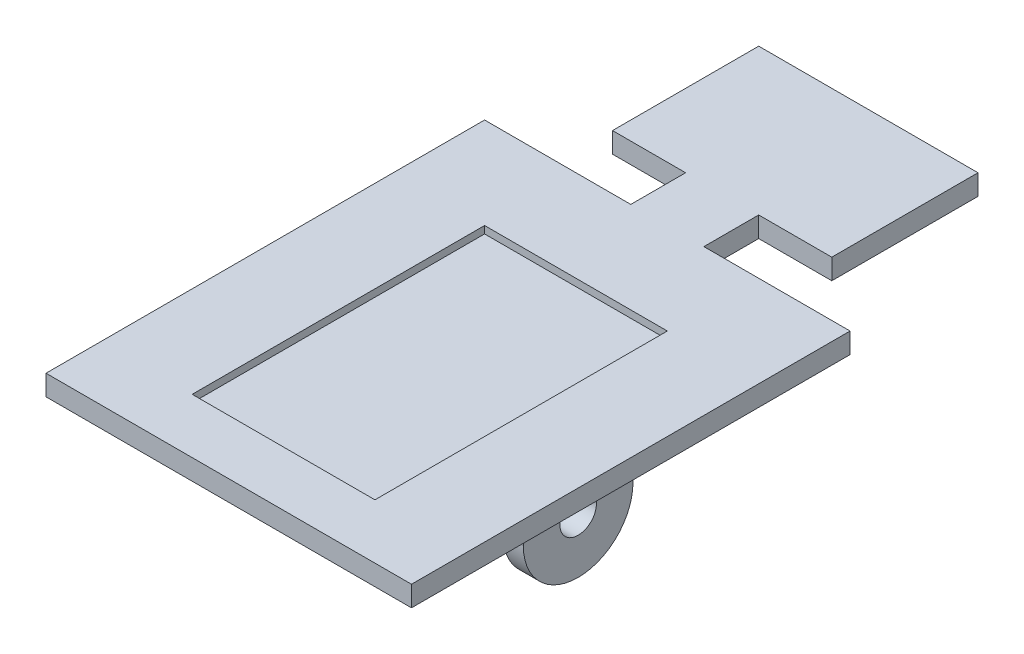
from build123d import *

# Parameters (mm, degrees)
BOSS_EXTRUDE1_DEPTH     = 2.8
SKETCH3_W               = 25
SKETCH3_H               = 40
CUT_EXTRUDE1_DEPTH      = 1
SKETCH4_W               = 2.8
SKETCH4_H               = 15
BOSS_EXTRUDE2_DEPTH     = 15
CUT_EXTRUDE2_DEPTH      = 76.211967133
CUT_EXTRUDE2_DEPTH_BACK = 76.211967133
SKETCH5_R               = 2.5


with BuildPart() as part:
    # Sketch2 → Boss-Extrude1 (new body)
    with BuildSketch(Plane(origin=(0, 0, 0), x_dir=(1, 0, 0), z_dir=(0, 1, 0))):
        Polygon((-15, 27.5), (15, 27.5), (15, 7.5), (5, 7.5), (5, 0), (25, 0), (25, -60), (-25, -60), (-25, 0), (-5, 0), (-5, 7.5), (-15, 7.5), align=None)
    extrude(amount=BOSS_EXTRUDE1_DEPTH)

    # Sketch3 → Cut-Extrude1 (cut)
    with BuildSketch(Plane(origin=(0, 2.8, 0), x_dir=(1, 0, 0), z_dir=(0, 1, 0))):
        with Locations((0, -32.5)):
            Rectangle(SKETCH3_W, SKETCH3_H)
    extrude(amount=-CUT_EXTRUDE1_DEPTH, mode=Mode.SUBTRACT)

    # Sketch4 → Boss-Extrude2 (add)
    with BuildSketch(Plane.XZ):
        with Locations((16.4, 30)):
            Rectangle(SKETCH4_W, SKETCH4_H)
        with Locations((-16.4, 30)):
            Rectangle(SKETCH4_W, SKETCH4_H)
    extrude(amount=BOSS_EXTRUDE2_DEPTH)

    # Sketch5 → Cut-Extrude2 (cut, two sides: drawn at the far end of the back side and taken through both)
    with BuildSketch(Plane(origin=(17.8, 0, 0), x_dir=(0, 0, -1), z_dir=(1, 0, 0)).offset(-CUT_EXTRUDE2_DEPTH_BACK)):
        with Locations((-30, -7.5)):
            Circle(SKETCH5_R)
        with BuildLine():
            Line((-22.5, -16.5), (-37.5, -16.5))
            Line((-37.5, -16.5), (-37.5, -7.5))
            ThreePointArc((-37.5, -7.5), (-30, -15), (-22.5, -7.5))
            Line((-22.5, -7.5), (-22.5, -16.5))
        make_face()
    extrude(amount=CUT_EXTRUDE2_DEPTH + CUT_EXTRUDE2_DEPTH_BACK, mode=Mode.SUBTRACT)


solid = part.part
